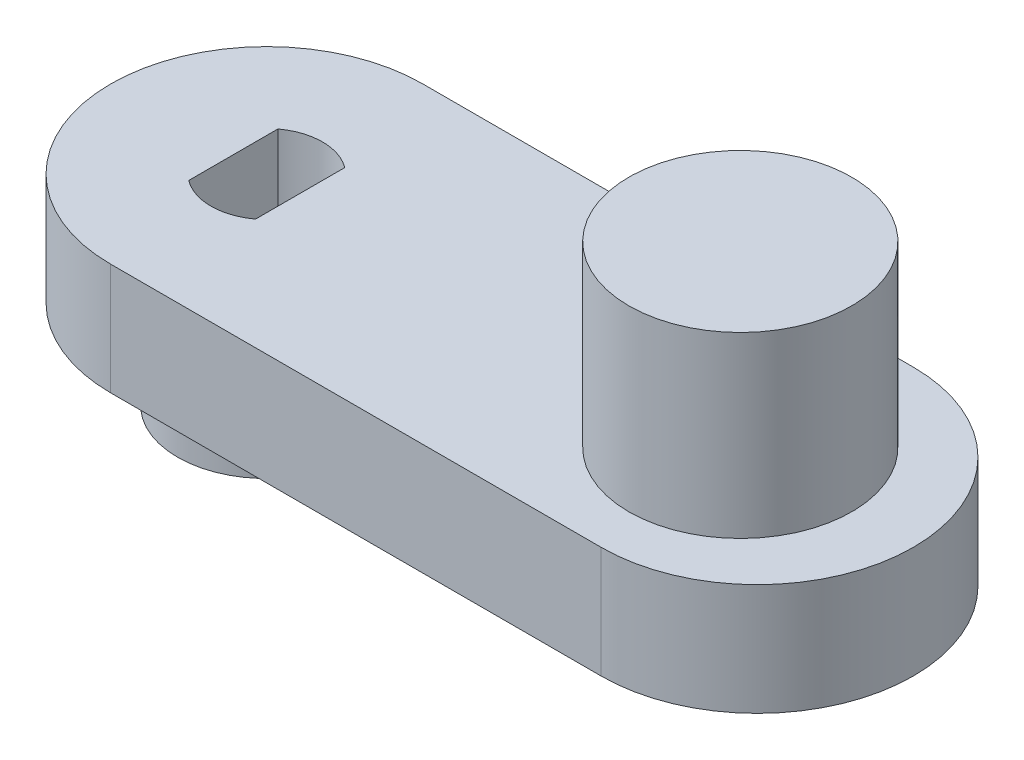
from build123d import *

# Parameters (mm, degrees)
BOSS_EXTRUDE1_DEPTH = 5
CUT_EXTRUDE1_DEPTH  = 5
SKETCH3_R           = 5
BOSS_EXTRUDE2_DEPTH = 8
SKETCH5_R           = 4
BOSS_EXTRUDE4_DEPTH = 4


with BuildPart() as part:
    # Sketch1 → Boss-Extrude1 (new body)
    with BuildSketch(Plane(origin=(0, 0, 0), x_dir=(1, 0, 0), z_dir=(0, 1, 0))):
        with BuildLine():
            Line((0, 7), (22, 7))
            ThreePointArc((22, 7), (29, 0), (22, -7))
            Line((22, -7), (0, -7))
            ThreePointArc((0, -7), (-7, 0), (0, 7))
        make_face()
    extrude(amount=BOSS_EXTRUDE1_DEPTH)

    # Sketch2 → Cut-Extrude1 (cut)
    with BuildSketch(Plane(origin=(0, 5, 0), x_dir=(1, 0, 0), z_dir=(0, 1, 0))):
        with BuildLine():
            Line((1.5, 2), (1.5, -2))
            ThreePointArc((1.5, -2), (0, -2.5), (-1.5, -2))
            Line((-1.5, -2), (-1.5, 2))
            ThreePointArc((-1.5, 2), (0, 2.5), (1.5, 2))
        make_face()
    extrude(amount=-CUT_EXTRUDE1_DEPTH, mode=Mode.SUBTRACT)

    # Sketch3 → Boss-Extrude2 (add)
    with BuildSketch(Plane(origin=(0, 5, 0), x_dir=(1, 0, 0), z_dir=(0, 1, 0))):
        with Locations(Location((21.24, 0, 0), (0, 0, 270))):
            Circle(SKETCH3_R)
    extrude(amount=BOSS_EXTRUDE2_DEPTH)

    # Sketch5 → Boss-Extrude4 (add)
    with BuildSketch(Plane.XZ):
        with Locations(Location((0, 0, 0), (0, 0, 90))):
            Circle(SKETCH5_R)
        with BuildLine():
            Line((-1.5, 2), (-1.5, -2))
            ThreePointArc((-1.5, -2), (0, -2.5), (1.5, -2))
            Line((1.5, -2), (1.5, 2))
            ThreePointArc((1.5, 2), (0, 2.5), (-1.5, 2))
        make_face(mode=Mode.SUBTRACT)
    extrude(amount=BOSS_EXTRUDE4_DEPTH)


solid = part.part
